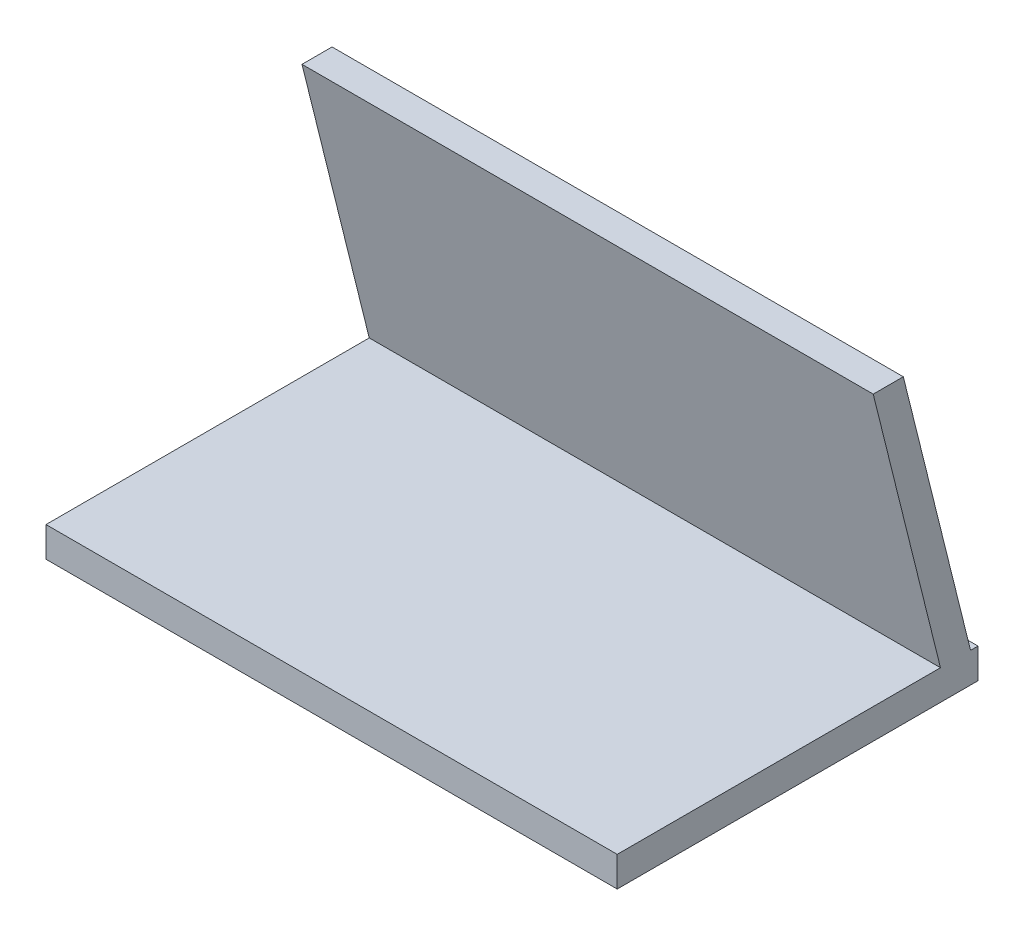
from build123d import *

# Parameters (mm, degrees)
SKETCH1_W           = 95
SKETCH1_H           = 60
BOSS_EXTRUDE1_DEPTH = 5
BOSS_EXTRUDE3_DEPTH = 95


with BuildPart() as part:
    # Sketch1 → Boss-Extrude1 (new body)
    with BuildSketch(Plane(origin=(0, 0, 0), x_dir=(1, 0, 0), z_dir=(0, 1, 0))):
        with Locations((47.5, -30)):
            Rectangle(SKETCH1_W, SKETCH1_H)
    extrude(amount=BOSS_EXTRUDE1_DEPTH)

    # Sketch6 → Boss-Extrude3 (add)
    with BuildSketch(Plane.ZY):
        Polygon((0, 0), (12.424467848, 50), (17.424467848, 50), (16.182021063, 45), (5, 0), align=None)
    extrude(amount=-BOSS_EXTRUDE3_DEPTH)


solid = part.part
